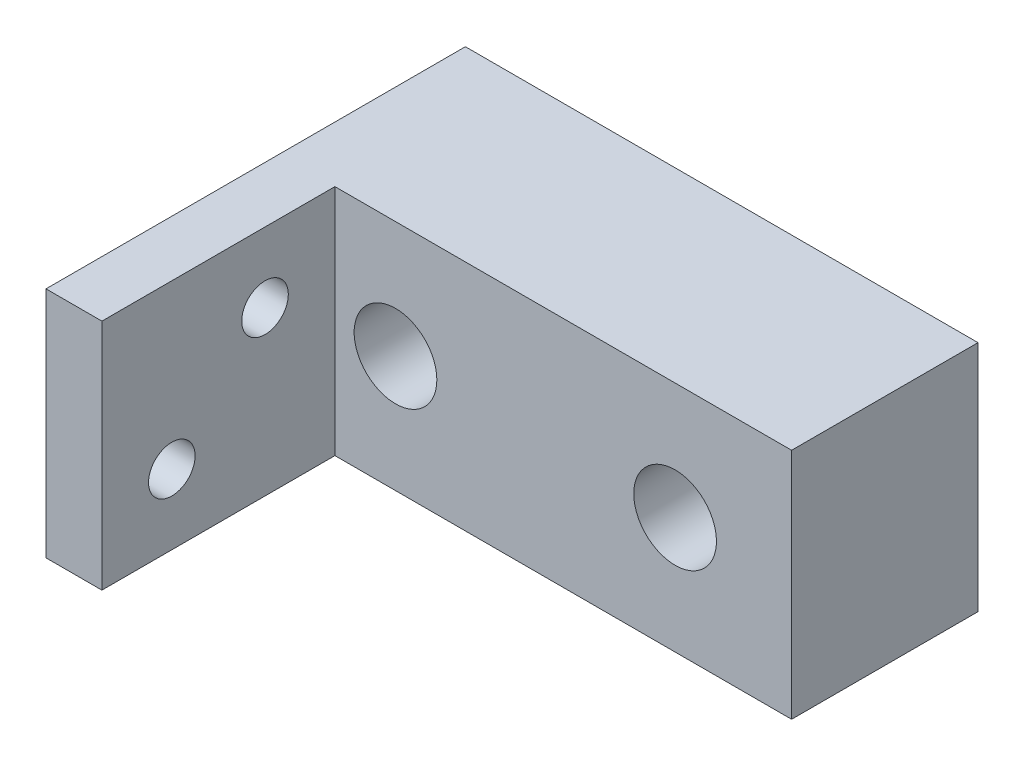
from build123d import *

# Parameters (mm, degrees)
SKETCH_1_W          = 55
SKETCH_1_H          = 25
SKETCH_1_R          = 4.435900657
EXTRUDE_1_DEPTH     = 20
SKETCH_2_W          = 6
SKETCH_2_H          = 25
EXTRUDE_2_DEPTH     = 25
SKETCH_3_R          = 2.5
CUT_EXTRUDE_1_DEPTH = 70.564485554


with BuildPart() as part:
    # 草图1 → 凸台-拉伸1 (new body)
    with BuildSketch(Plane.XY):
        with Locations((-22.681333333, 7.827755665)):
            Rectangle(SKETCH_1_W, SKETCH_1_H)
        with Locations((-37.681333333, 7.827755665)):
            Circle(SKETCH_1_R, mode=Mode.SUBTRACT)
        with Locations(Location((-7.681333333, 7.827755665, 0), (0, 0, 180))):
            Circle(SKETCH_1_R, mode=Mode.SUBTRACT)
    extrude(amount=EXTRUDE_1_DEPTH)

    # 草图2 → 凸台-拉伸2 (add)
    with BuildSketch(Plane.XY.offset(20)):
        with Locations((-47.181333333, 7.827755665)):
            Rectangle(SKETCH_2_W, SKETCH_2_H)
    extrude(amount=EXTRUDE_2_DEPTH)

    # 草图3 → 切除-拉伸1 (cut, through all)
    with BuildSketch(Plane(origin=(-44.181333333, 0, 0), x_dir=(0, 0, -1), z_dir=(1, 0, 0))):
        with Locations((-37.5, 2.827755665)):
            Circle(SKETCH_3_R)
        with Locations((-27.5, 12.827755665)):
            Circle(SKETCH_3_R)
    extrude(amount=-CUT_EXTRUDE_1_DEPTH, mode=Mode.SUBTRACT)


solid = part.part
